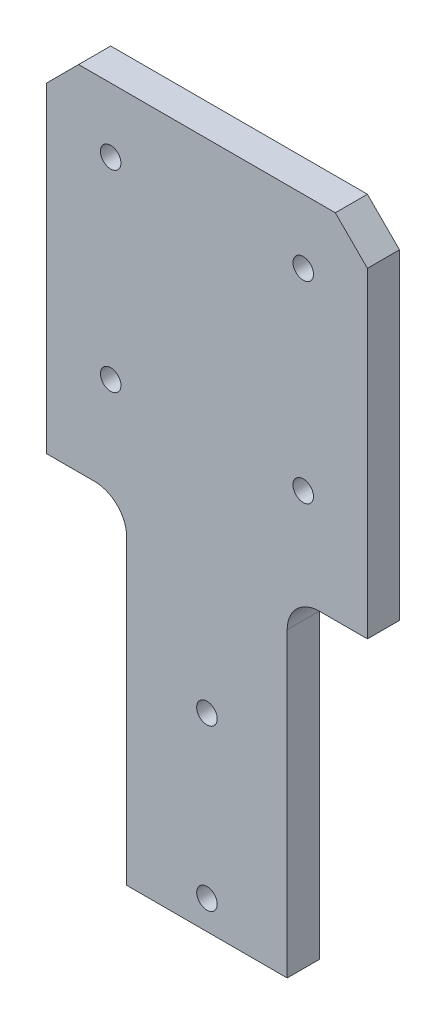
from build123d import *

# Parameters (mm, degrees)
SKETCH1_R           = 1.6
BOSS_EXTRUDE1_DEPTH = 5
FILLET1_R           = 5


with BuildPart() as part:
    # Sketch1 → Boss-Extrude1 (new body)
    with BuildSketch(Plane.XY):
        Polygon((-12.5, 26), (-12.5, -26), (12.5, -26), (12.5, 26), (25, 26), (25, 76), (20, 81), (-20, 81), (-25, 76), (-25, 26), align=None)
        with Locations((0, -21.5)):
            Circle(SKETCH1_R, mode=Mode.SUBTRACT)
        with Locations((0, 3.5)):
            Circle(SKETCH1_R, mode=Mode.SUBTRACT)
        with Locations((-15, 71)):
            Circle(SKETCH1_R, mode=Mode.SUBTRACT)
        with Locations((15, 71)):
            Circle(SKETCH1_R, mode=Mode.SUBTRACT)
        with Locations((-15, 41)):
            Circle(SKETCH1_R, mode=Mode.SUBTRACT)
        with Locations((15, 41)):
            Circle(SKETCH1_R, mode=Mode.SUBTRACT)
    extrude(amount=BOSS_EXTRUDE1_DEPTH)

    # Fillet1
    fillet1_edges = [part.edges().sort_by_distance(p)[0] for p in [
        (-12.5, 26, 2.5),
        (12.5, 26, 2.5),
    ]]
    fillet(fillet1_edges, radius=FILLET1_R)


solid = part.part
